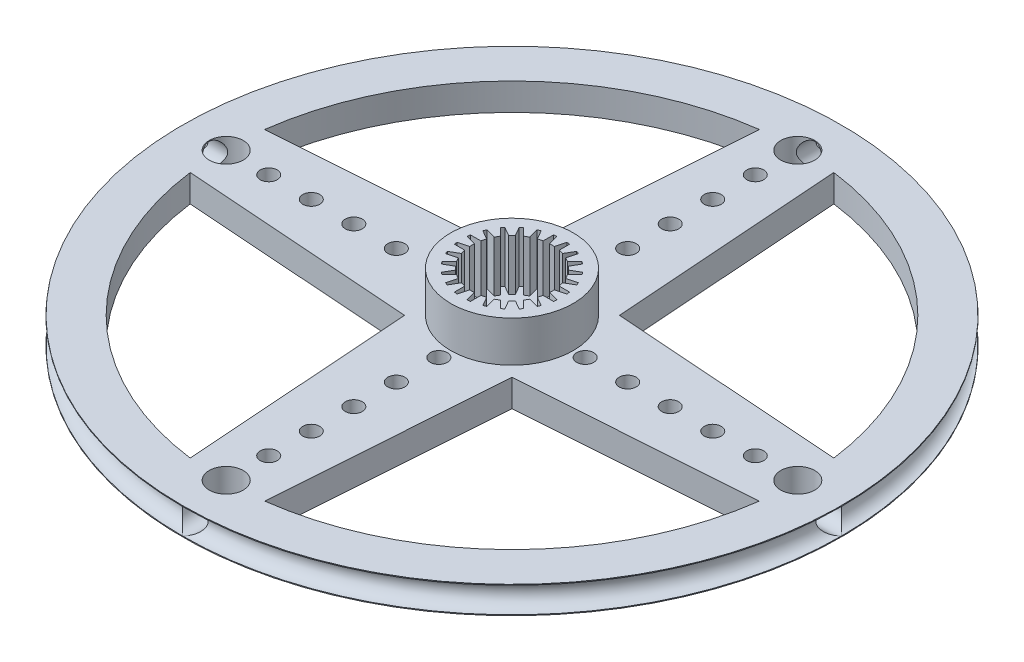
from build123d import *

# Parameters (mm, degrees)
ESQUISSE1_R                             = 3.75
ESQUISSE1_R_2                           = 1.65
BOSS_EXTRU_1_DEPTH                      = 4
BOSS_EXTRU_2_DEPTH                      = 4
R_P_TITION_CIRCULAIRE1_COUNT            = 4
ESQUISSE3_R                             = 0.5
ENL_V_MAT_EXTRU_1_DEPTH                 = 8
R_P_TITION_LIN_AIRE1_COUNT              = 6
R_P_TITION_LIN_AIRE1_PITCH              = 2.5
R_P_TITION_CIRCULAIRE2_COUNT            = 4
R_P_TITION_CIRCULAIRE2_COPY_1_SKETCH_R  = 0.5
R_P_TITION_CIRCULAIRE2_COPY_1_DEPTH     = 8
R_P_TITION_CIRCULAIRE2_COPY_2_SKETCH_R  = 0.5
R_P_TITION_CIRCULAIRE2_COPY_2_DEPTH     = 8
R_P_TITION_CIRCULAIRE2_COPY_3_SKETCH_R  = 0.5
R_P_TITION_CIRCULAIRE2_COPY_3_DEPTH     = 8
R_P_TITION_CIRCULAIRE2_COPY_4_SKETCH_R  = 0.5
R_P_TITION_CIRCULAIRE2_COPY_4_DEPTH     = 8
R_P_TITION_CIRCULAIRE2_COPY_5_SKETCH_R  = 0.5
R_P_TITION_CIRCULAIRE2_COPY_5_DEPTH     = 8
R_P_TITION_CIRCULAIRE2_COPY_6_SKETCH_R  = 0.5
R_P_TITION_CIRCULAIRE2_COPY_6_DEPTH     = 8
R_P_TITION_CIRCULAIRE2_COPY_7_SKETCH_R  = 0.5
R_P_TITION_CIRCULAIRE2_COPY_7_DEPTH     = 8
R_P_TITION_CIRCULAIRE2_COPY_8_SKETCH_R  = 0.5
R_P_TITION_CIRCULAIRE2_COPY_8_DEPTH     = 8
R_P_TITION_CIRCULAIRE2_COPY_9_SKETCH_R  = 0.5
R_P_TITION_CIRCULAIRE2_COPY_9_DEPTH     = 8
R_P_TITION_CIRCULAIRE2_COPY_10_SKETCH_R = 0.5
R_P_TITION_CIRCULAIRE2_COPY_10_DEPTH    = 8
R_P_TITION_CIRCULAIRE2_COPY_11_SKETCH_R = 0.5
R_P_TITION_CIRCULAIRE2_COPY_11_DEPTH    = 8
R_P_TITION_CIRCULAIRE2_COPY_12_SKETCH_R = 0.5
R_P_TITION_CIRCULAIRE2_COPY_12_DEPTH    = 8
R_P_TITION_CIRCULAIRE2_COPY_13_SKETCH_R = 0.5
R_P_TITION_CIRCULAIRE2_COPY_13_DEPTH    = 8
R_P_TITION_CIRCULAIRE2_COPY_14_SKETCH_R = 0.5
R_P_TITION_CIRCULAIRE2_COPY_14_DEPTH    = 8
R_P_TITION_CIRCULAIRE2_COPY_15_SKETCH_R = 0.5
R_P_TITION_CIRCULAIRE2_COPY_15_DEPTH    = 8
ESQUISSE4_W                             = 74.025208854
ESQUISSE4_H                             = 65.087506081
ESQUISSE4_R                             = 3.6
ENL_V_MAT_EXTRU_2_DEPTH                 = 2.4
ESQUISSE5_R                             = 2.95
ENL_V_MAT_EXTRU_3_DEPTH                 = 5
BOSS_EXTRUDE2_START                     = -1
SKETCH5_R                               = 2.95
SKETCH5_R_2                             = 1.2
BOSS_EXTRUDE2_DEPTH                     = 1
BOSS_EXTRU_3_DEPTH                      = 3
R_P_TITION_CIRCULAIRE3_COUNT            = 24
SKETCH6_R                               = 2.45
CUT_EXTRUDE2_DEPTH                      = 0.6
BOSS_EXTRUDE3_START                     = -1.6
BOSS_EXTRUDE3_DEPTH                     = 1.6
SKETCH8_R                               = 0.75
SKETCH9_R                               = 0.75
CUT_EXTRUDE3_DEPTH                      = 2.5
CUT_EXTRUDE4_START                      = -1.6
SKETCH10_R                              = 1
SKETCH10_R_2                            = 0.5
CUT_EXTRUDE4_DEPTH                      = 1.6
CIRPATTERN1_COUNT                       = 4


with BuildPart() as part:
    # Esquisse1 → Boss.-Extru.1 (new body)
    with BuildSketch(Plane(origin=(0, 0, 0), x_dir=(1, 0, 0), z_dir=(0, 1, 0))):
        with Locations(Location((0, 0, 0), (0, 0, 270))):
            Circle(ESQUISSE1_R)
        with Locations(Location((0, 0, 0), (0, 0, 270))):
            Circle(ESQUISSE1_R_2, mode=Mode.SUBTRACT)
    extrude(amount=BOSS_EXTRU_1_DEPTH)

    # Esquisse2 → Boss.-Extru.2 (add)
    with BuildSketch(Plane(origin=(0, 4, 0), x_dir=(1, 0, 0), z_dir=(0, 1, 0))):
        with BuildLine():
            Line((-3.25, 1.870828693), (-2.144554929, 17.373747489))
            ThreePointArc((-2.144554929, 17.373747489), (0, 19.370828693), (2.144554929, 17.373747489))
            Line((2.144554929, 17.373747489), (3.25, 1.870828693))
            Line((3.25, 1.870828693), (-3.25, 1.870828693))
        make_face()
    boss_extru_2 = extrude(amount=-BOSS_EXTRU_2_DEPTH)

    # Répétition circulaire1: Boss.-Extru.2 ×4 about axis
    r_p_tition_circulaire1_axis = Axis((0, 0, 0), (0, 1, 0))
    for i in range(1, R_P_TITION_CIRCULAIRE1_COUNT):
        add(boss_extru_2.rotate(r_p_tition_circulaire1_axis, i * 360 / R_P_TITION_CIRCULAIRE1_COUNT))

    # Esquisse3 → Enlèv. mat.-Extru.1 (cut)
    with BuildSketch(Plane(origin=(0, 4, 0), x_dir=(1, 0, 0), z_dir=(0, 1, 0))):
        with Locations(Location((0, 4.3, 0), (0, 0, 270))):
            Circle(ESQUISSE3_R)
    enl_v_mat_extru_1 = extrude(amount=-ENL_V_MAT_EXTRU_1_DEPTH, mode=Mode.SUBTRACT)

    # Répétition linéaire1: Enlèv. mat.-Extru.1 ×6
    with Locations(*[(0, 0, -i * R_P_TITION_LIN_AIRE1_PITCH) for i in range(1, R_P_TITION_LIN_AIRE1_COUNT)]):
        add(enl_v_mat_extru_1, mode=Mode.SUBTRACT)

    # Répétition circulaire2: Enlèv. mat.-Extru.1 ×4 about axis
    r_p_tition_circulaire2_axis = Axis((0, 0, 0), (0, 1, 0))
    for i in range(1, R_P_TITION_CIRCULAIRE2_COUNT):
        add(enl_v_mat_extru_1.rotate(r_p_tition_circulaire2_axis, i * 360 / R_P_TITION_CIRCULAIRE2_COUNT), mode=Mode.SUBTRACT)

    # Répétition circulaire2 copy 1 sketch → Répétition circulaire2 copy 1 (cut)
    with BuildSketch(Plane(origin=(-2.5, 4, 0), x_dir=(0, 0, -1), z_dir=(0, 1, 0))):
        with Locations(Location((0, 4.3, 0), (0, 0, 270))):
            Circle(R_P_TITION_CIRCULAIRE2_COPY_1_SKETCH_R)
    extrude(amount=-R_P_TITION_CIRCULAIRE2_COPY_1_DEPTH, mode=Mode.SUBTRACT)

    # Répétition circulaire2 copy 2 sketch → Répétition circulaire2 copy 2 (cut)
    with BuildSketch(Plane(origin=(0, 4, 2.5), x_dir=(-1, 0, 0), z_dir=(0, 1, 0))):
        with Locations(Location((0, 4.3, 0), (0, 0, 270))):
            Circle(R_P_TITION_CIRCULAIRE2_COPY_2_SKETCH_R)
    extrude(amount=-R_P_TITION_CIRCULAIRE2_COPY_2_DEPTH, mode=Mode.SUBTRACT)

    # Répétition circulaire2 copy 3 sketch → Répétition circulaire2 copy 3 (cut)
    with BuildSketch(Plane(origin=(2.5, 4, 0), x_dir=(0, 0, 1), z_dir=(0, 1, 0))):
        with Locations(Location((0, 4.3, 0), (0, 0, 270))):
            Circle(R_P_TITION_CIRCULAIRE2_COPY_3_SKETCH_R)
    extrude(amount=-R_P_TITION_CIRCULAIRE2_COPY_3_DEPTH, mode=Mode.SUBTRACT)

    # Répétition circulaire2 copy 4 sketch → Répétition circulaire2 copy 4 (cut)
    with BuildSketch(Plane(origin=(-5, 4, 0), x_dir=(0, 0, -1), z_dir=(0, 1, 0))):
        with Locations(Location((0, 4.3, 0), (0, 0, 270))):
            Circle(R_P_TITION_CIRCULAIRE2_COPY_4_SKETCH_R)
    extrude(amount=-R_P_TITION_CIRCULAIRE2_COPY_4_DEPTH, mode=Mode.SUBTRACT)

    # Répétition circulaire2 copy 5 sketch → Répétition circulaire2 copy 5 (cut)
    with BuildSketch(Plane(origin=(0, 4, 5), x_dir=(-1, 0, 0), z_dir=(0, 1, 0))):
        with Locations(Location((0, 4.3, 0), (0, 0, 270))):
            Circle(R_P_TITION_CIRCULAIRE2_COPY_5_SKETCH_R)
    extrude(amount=-R_P_TITION_CIRCULAIRE2_COPY_5_DEPTH, mode=Mode.SUBTRACT)

    # Répétition circulaire2 copy 6 sketch → Répétition circulaire2 copy 6 (cut)
    with BuildSketch(Plane(origin=(5, 4, 0), x_dir=(0, 0, 1), z_dir=(0, 1, 0))):
        with Locations(Location((0, 4.3, 0), (0, 0, 270))):
            Circle(R_P_TITION_CIRCULAIRE2_COPY_6_SKETCH_R)
    extrude(amount=-R_P_TITION_CIRCULAIRE2_COPY_6_DEPTH, mode=Mode.SUBTRACT)

    # Répétition circulaire2 copy 7 sketch → Répétition circulaire2 copy 7 (cut)
    with BuildSketch(Plane(origin=(-7.5, 4, 0), x_dir=(0, 0, -1), z_dir=(0, 1, 0))):
        with Locations(Location((0, 4.3, 0), (0, 0, 270))):
            Circle(R_P_TITION_CIRCULAIRE2_COPY_7_SKETCH_R)
    extrude(amount=-R_P_TITION_CIRCULAIRE2_COPY_7_DEPTH, mode=Mode.SUBTRACT)

    # Répétition circulaire2 copy 8 sketch → Répétition circulaire2 copy 8 (cut)
    with BuildSketch(Plane(origin=(0, 4, 7.5), x_dir=(-1, 0, 0), z_dir=(0, 1, 0))):
        with Locations(Location((0, 4.3, 0), (0, 0, 270))):
            Circle(R_P_TITION_CIRCULAIRE2_COPY_8_SKETCH_R)
    extrude(amount=-R_P_TITION_CIRCULAIRE2_COPY_8_DEPTH, mode=Mode.SUBTRACT)

    # Répétition circulaire2 copy 9 sketch → Répétition circulaire2 copy 9 (cut)
    with BuildSketch(Plane(origin=(7.5, 4, 0), x_dir=(0, 0, 1), z_dir=(0, 1, 0))):
        with Locations(Location((0, 4.3, 0), (0, 0, 270))):
            Circle(R_P_TITION_CIRCULAIRE2_COPY_9_SKETCH_R)
    extrude(amount=-R_P_TITION_CIRCULAIRE2_COPY_9_DEPTH, mode=Mode.SUBTRACT)

    # Répétition circulaire2 copy 10 sketch → Répétition circulaire2 copy 10 (cut)
    with BuildSketch(Plane(origin=(-10, 4, 0), x_dir=(0, 0, -1), z_dir=(0, 1, 0))):
        with Locations(Location((0, 4.3, 0), (0, 0, 270))):
            Circle(R_P_TITION_CIRCULAIRE2_COPY_10_SKETCH_R)
    extrude(amount=-R_P_TITION_CIRCULAIRE2_COPY_10_DEPTH, mode=Mode.SUBTRACT)

    # Répétition circulaire2 copy 11 sketch → Répétition circulaire2 copy 11 (cut)
    with BuildSketch(Plane(origin=(0, 4, 10), x_dir=(-1, 0, 0), z_dir=(0, 1, 0))):
        with Locations(Location((0, 4.3, 0), (0, 0, 270))):
            Circle(R_P_TITION_CIRCULAIRE2_COPY_11_SKETCH_R)
    extrude(amount=-R_P_TITION_CIRCULAIRE2_COPY_11_DEPTH, mode=Mode.SUBTRACT)

    # Répétition circulaire2 copy 12 sketch → Répétition circulaire2 copy 12 (cut)
    with BuildSketch(Plane(origin=(10, 4, 0), x_dir=(0, 0, 1), z_dir=(0, 1, 0))):
        with Locations(Location((0, 4.3, 0), (0, 0, 270))):
            Circle(R_P_TITION_CIRCULAIRE2_COPY_12_SKETCH_R)
    extrude(amount=-R_P_TITION_CIRCULAIRE2_COPY_12_DEPTH, mode=Mode.SUBTRACT)

    # Répétition circulaire2 copy 13 sketch → Répétition circulaire2 copy 13 (cut)
    with BuildSketch(Plane(origin=(-12.5, 4, 0), x_dir=(0, 0, -1), z_dir=(0, 1, 0))):
        with Locations(Location((0, 4.3, 0), (0, 0, 270))):
            Circle(R_P_TITION_CIRCULAIRE2_COPY_13_SKETCH_R)
    extrude(amount=-R_P_TITION_CIRCULAIRE2_COPY_13_DEPTH, mode=Mode.SUBTRACT)

    # Répétition circulaire2 copy 14 sketch → Répétition circulaire2 copy 14 (cut)
    with BuildSketch(Plane(origin=(0, 4, 12.5), x_dir=(-1, 0, 0), z_dir=(0, 1, 0))):
        with Locations(Location((0, 4.3, 0), (0, 0, 270))):
            Circle(R_P_TITION_CIRCULAIRE2_COPY_14_SKETCH_R)
    extrude(amount=-R_P_TITION_CIRCULAIRE2_COPY_14_DEPTH, mode=Mode.SUBTRACT)

    # Répétition circulaire2 copy 15 sketch → Répétition circulaire2 copy 15 (cut)
    with BuildSketch(Plane(origin=(12.5, 4, 0), x_dir=(0, 0, 1), z_dir=(0, 1, 0))):
        with Locations(Location((0, 4.3, 0), (0, 0, 270))):
            Circle(R_P_TITION_CIRCULAIRE2_COPY_15_SKETCH_R)
    extrude(amount=-R_P_TITION_CIRCULAIRE2_COPY_15_DEPTH, mode=Mode.SUBTRACT)

    # Esquisse4 → Enlèv. mat.-Extru.2 (cut)
    with BuildSketch(Plane(origin=(0, 4, 0), x_dir=(1, 0, 0), z_dir=(0, 1, 0))):
        with Locations((-0.052574722, -0.420597777)):
            Rectangle(ESQUISSE4_W, ESQUISSE4_H)
        with Locations(Location((0, 0, 0), (0, 0, 270))):
            Circle(ESQUISSE4_R, mode=Mode.SUBTRACT)
    extrude(amount=-ENL_V_MAT_EXTRU_2_DEPTH, mode=Mode.SUBTRACT)

    # Esquisse5 → Enlèv. mat.-Extru.3 (cut)
    with BuildSketch(Plane(origin=(0, 4, 0), x_dir=(1, 0, 0), z_dir=(0, 1, 0))):
        with Locations(Location((0, 0, 0), (0, 0, 270))):
            Circle(ESQUISSE5_R)
    extrude(amount=-ENL_V_MAT_EXTRU_3_DEPTH, mode=Mode.SUBTRACT)

    # Sketch5 → Boss-Extrude2 (add)
    with BuildSketch(Plane.XZ.offset(BOSS_EXTRUDE2_START)):
        with Locations(Location((0, 0, 0), (0, 0, 90))):
            Circle(SKETCH5_R)
        with Locations(Location((0, 0, 0), (0, 0, 270))):
            Circle(SKETCH5_R_2, mode=Mode.SUBTRACT)
    extrude(amount=BOSS_EXTRUDE2_DEPTH)

    # Esquisse6 → Boss.-Extru.3 (add)
    with BuildSketch(Plane(origin=(0, 4, 0), x_dir=(1, 0, 0), z_dir=(0, 1, 0))):
        Polygon((-0.3, 2.95), (-0.139230485, 2.35), (0.139230485, 2.35), (0.3, 2.95), align=None)
    boss_extru_3 = extrude(amount=-BOSS_EXTRU_3_DEPTH)

    # Répétition circulaire3: Boss.-Extru.3 ×24 about axis
    r_p_tition_circulaire3_axis = Axis((0, 0, 0), (0, 1, 0))
    for i in range(1, R_P_TITION_CIRCULAIRE3_COUNT):
        add(boss_extru_3.rotate(r_p_tition_circulaire3_axis, i * 360 / R_P_TITION_CIRCULAIRE3_COUNT))

    # Sketch6 → Cut-Extrude2 (cut)
    with BuildSketch(Plane.XZ):
        with Locations(Location((0, 0, 0), (0, 0, 270))):
            Circle(SKETCH6_R)
    extrude(amount=-CUT_EXTRUDE2_DEPTH, mode=Mode.SUBTRACT)

    # Sketch7 → Boss-Extrude3 (add)
    with BuildSketch(Plane.XZ.offset(BOSS_EXTRUDE3_START)):
        with BuildLine():
            ThreePointArc((-2.144554929, 17.373747489), (-1.465217494, 18.794244625), (-1.1e-08, 19.370828693))
            ThreePointArc((-1.1e-08, 19.370828693), (-13.69724433, 13.697244323), (-19.370828693, 0))
            ThreePointArc((-19.370828693, 0), (-18.794244629, 1.46521749), (-17.373747489, 2.144554929))
            Line((-17.373747489, 2.144554929), (-16.728004433, 2.190600031))
            ThreePointArc((-16.728004433, 2.190600031), (-11.929477373, 11.929477373), (-2.190600031, 16.728004433))
            Line((-2.190600031, 16.728004433), (-2.144554929, 17.373747489))
        make_face()
        with BuildLine():
            ThreePointArc((-19.370828693, 0), (-13.697244323, -13.69724433), (1.1e-08, -19.370828693))
            ThreePointArc((1.1e-08, -19.370828693), (-1.465217487, -18.794244632), (-2.144554929, -17.373747489))
            Line((-2.144554929, -17.373747489), (-2.190600031, -16.728004433))
            ThreePointArc((-2.190600031, -16.728004433), (-11.929477373, -11.929477373), (-16.728004433, -2.190600031))
            Line((-16.728004433, -2.190600031), (-17.373747489, -2.144554929))
            ThreePointArc((-17.373747489, -2.144554929), (-18.794244629, -1.46521749), (-19.370828693, 0))
        make_face()
        with BuildLine():
            ThreePointArc((1.1e-08, -19.370828693), (13.69724433, -13.697244323), (19.370828693, 0))
            ThreePointArc((19.370828693, 0), (18.794244629, -1.46521749), (17.373747489, -2.144554929))
            Line((17.373747489, -2.144554929), (16.728004433, -2.190600031))
            ThreePointArc((16.728004433, -2.190600031), (11.929477373, -11.929477373), (2.190600031, -16.728004433))
            Line((2.190600031, -16.728004433), (2.144554929, -17.373747489))
            ThreePointArc((2.144554929, -17.373747489), (1.465217494, -18.794244625), (1.1e-08, -19.370828693))
        make_face()
        with BuildLine():
            ThreePointArc((17.373747489, 2.144554929), (18.794244629, 1.46521749), (19.370828693, 0))
            ThreePointArc((19.370828693, 0), (13.697244323, 13.69724433), (-1.1e-08, 19.370828693))
            ThreePointArc((-1.1e-08, 19.370828693), (1.465217487, 18.794244632), (2.144554929, 17.373747489))
            Line((2.144554929, 17.373747489), (2.190600031, 16.728004433))
            ThreePointArc((2.190600031, 16.728004433), (11.929477373, 11.929477373), (16.728004433, 2.190600031))
            Line((16.728004433, 2.190600031), (17.373747489, 2.144554929))
        make_face()
    extrude(amount=BOSS_EXTRUDE3_DEPTH)

    # Sketch8 → Cut-Revolve1 (revolve, cut)
    with BuildSketch(Plane.XY, mode=Mode.PRIVATE) as cut_revolve1_sk:
        with Locations((19.370828693, 0.8)):
            Circle(SKETCH8_R)
    revolve(cut_revolve1_sk.sketch.rotate(Axis((0, 0, 0), (0, 1, 0)), 90), axis=Axis((0, 0, 0), (0, 1, 0)), mode=Mode.SUBTRACT)

    # Sketch9 → Cut-Extrude3 (cut)
    with BuildSketch(Plane.ZY.offset(19.370828693)):
        with Locations(Location((0, 0.8, 0), (0, 0, 311.295589155))):
            Circle(SKETCH9_R)
    cut_extrude3 = extrude(amount=-CUT_EXTRUDE3_DEPTH, mode=Mode.SUBTRACT)

    # Sketch10 → Cut-Extrude4 (cut)
    with BuildSketch(Plane.XZ.offset(CUT_EXTRUDE4_START)):
        with Locations(Location((-16.8, 0, 0), (0, 0, 270))):
            Circle(SKETCH10_R)
        with Locations((-16.8, 0)):
            Circle(SKETCH10_R_2, mode=Mode.SUBTRACT)
    cut_extrude4 = extrude(amount=CUT_EXTRUDE4_DEPTH, mode=Mode.SUBTRACT)

    # CirPattern1: Cut-Extrude3, Cut-Extrude4 ×4 about axis
    cirpattern1_axis = Axis((0, 0, 0), (0, 1, 0))
    add([cut_extrude3.rotate(cirpattern1_axis, i * 360 / CIRPATTERN1_COUNT) for i in range(1, CIRPATTERN1_COUNT)], mode=Mode.SUBTRACT)
    add([cut_extrude4.rotate(cirpattern1_axis, i * 360 / CIRPATTERN1_COUNT) for i in range(1, CIRPATTERN1_COUNT)], mode=Mode.SUBTRACT)


solid = part.part
